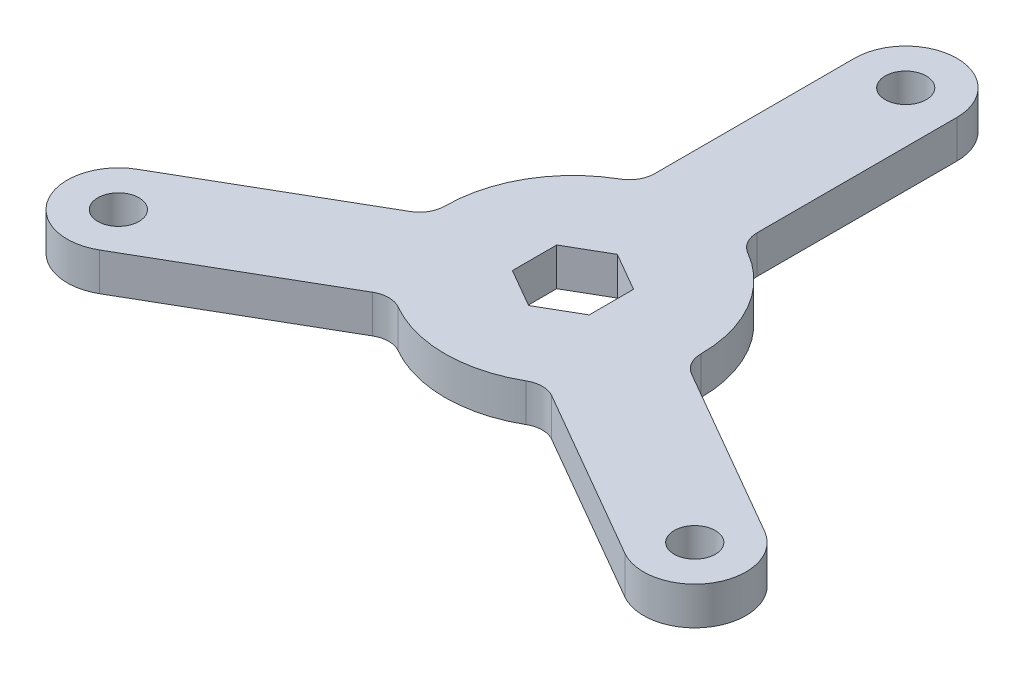
from build123d import *

# Parameters (mm, degrees)
SKETCH1_R                = 15.875
BOSS_EXTRUDE1_DEPTH      = 2.3495
SKETCH2_R                = 2.5527
BOSS_EXTRUDE2_DEPTH      = 4.699
FILLET1_R                = 3.175
CIRPATTERN1_COUNT        = 3
FILLET1_OF_CIRPATTERN1_R = 3.175


with BuildPart() as part:
    # Sketch1 → Boss-Extrude1 (new, symmetric)
    with BuildSketch(Plane(origin=(0, 0, 0), x_dir=(1, 0, 0), z_dir=(0, 1, 0))):
        with Locations(Location((0, 0, 0), (0, 0, 270))):
            Circle(SKETCH1_R)
        Polygon((0, 5.499261314), (-4.7625, 2.749630657), (-4.7625, -2.749630657), (0, -5.499261314), (4.7625, -2.749630657), (4.7625, 2.749630657), align=None, mode=Mode.SUBTRACT)
    extrude(amount=BOSS_EXTRUDE1_DEPTH, both=True)

    # Sketch2 → Boss-Extrude2 (add)
    with BuildSketch(Plane(origin=(0, 2.3495, 0), x_dir=(1, 0, 0), z_dir=(0, 1, 0))):
        with BuildLine():
            Line((-6.35, 41.275), (-6.35, 14.549677831))
            ThreePointArc((-6.35, 14.549677831), (0, 15.875), (6.35, 14.549677831))
            Line((6.35, 14.549677831), (6.35, 41.275))
            ThreePointArc((6.35, 41.275), (0, 47.625), (-6.35, 41.275))
        make_face()
        with Locations(Location((0, 41.275, 0), (0, 0, 270))):
            Circle(SKETCH2_R, mode=Mode.SUBTRACT)
    boss_extrude2 = extrude(amount=-BOSS_EXTRUDE2_DEPTH)

    # Fillet1
    fillet1_edges = [part.edges().sort_by_distance(p)[0] for p in [
        (-6.35, 0, -14.549677831),
        (6.35, 0, -14.549677831),
    ]]
    fillet(fillet1_edges, radius=FILLET1_R)

    # CirPattern1: Boss-Extrude2 ×3 about axis
    cirpattern1_axis = Axis((0, 0, 0), (0, 1, 0))
    for i in range(1, CIRPATTERN1_COUNT):
        add(boss_extrude2.rotate(cirpattern1_axis, i * 360 / CIRPATTERN1_COUNT))

    # Fillet1 of CirPattern1
    fillet1_of_cirpattern1_edges = [part.edges().sort_by_distance(p)[0] for p in [
        (-9.425390619, 0, 12.77410023),
        (-15.775390619, 0, 1.775577602),
        (15.775390619, 0, 1.775577602),
        (9.425390619, 0, 12.77410023),
    ]]
    fillet(fillet1_of_cirpattern1_edges, radius=FILLET1_OF_CIRPATTERN1_R)


solid = part.part
